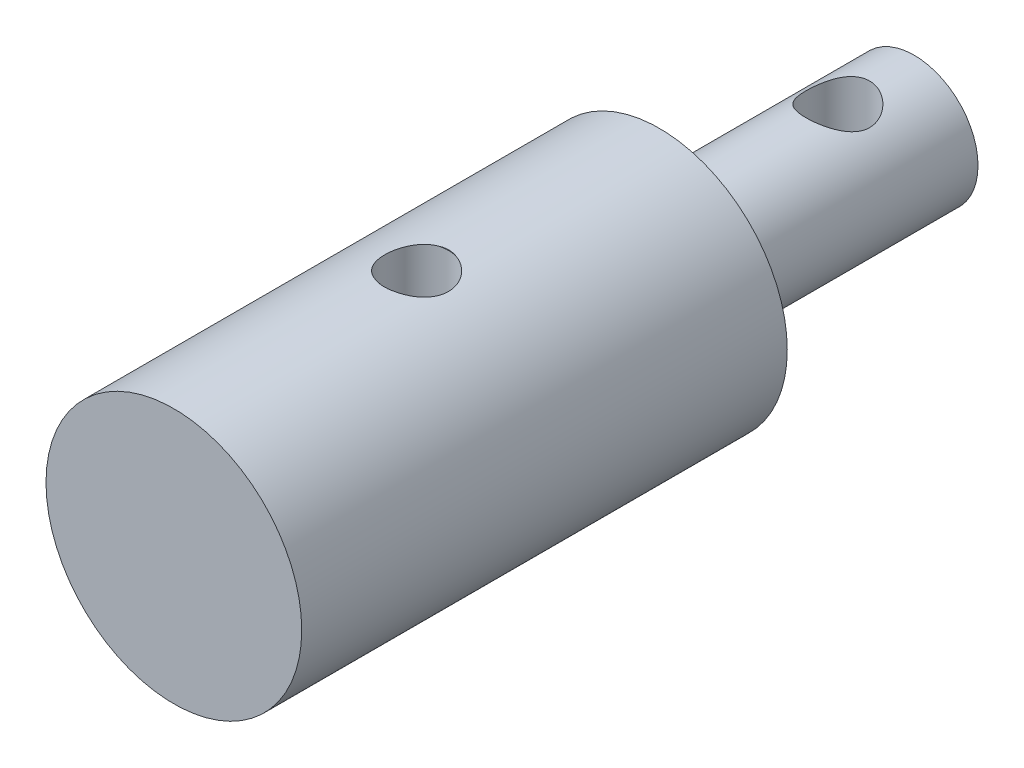
from build123d import *

# Parameters (mm, degrees)
SKETCH1_R                       = 5
BOSS_EXTRUDE1_DEPTH             = 20
SKETCH2_R                       = 10.033
BOSS_EXTRUDE2_DEPTH             = 38.1
F_5_0MM_DOWEL_HOLE1_D           = 5
F_5_0MM_DOWEL_HOLE1_CSINK_D     = 5.05
F_5_0MM_DOWEL_HOLE1_CSINK_ANGLE = 90


with BuildPart() as part:
    # Sketch1 → Boss-Extrude1 (new body)
    with BuildSketch(Plane.XY):
        Circle(SKETCH1_R)
    extrude(amount=BOSS_EXTRUDE1_DEPTH)

    # Sketch2 → Boss-Extrude2 (add)
    with BuildSketch(Plane.XY.offset(20)):
        with Locations(Location((0, 0, 0), (0, 0, 180))):
            Circle(SKETCH2_R)
    extrude(amount=BOSS_EXTRUDE2_DEPTH)

    # Ø5.0mm Dowel Hole1 (through all)
    with Locations(Plane(origin=(0, 10.033, 0), x_dir=(1, 0, 0), z_dir=(0, 1, 0))):
        with Locations((0, -6), (0, -39.05)):
            CounterSinkHole(F_5_0MM_DOWEL_HOLE1_D / 2, F_5_0MM_DOWEL_HOLE1_CSINK_D / 2, counter_sink_angle=F_5_0MM_DOWEL_HOLE1_CSINK_ANGLE)


solid = part.part
